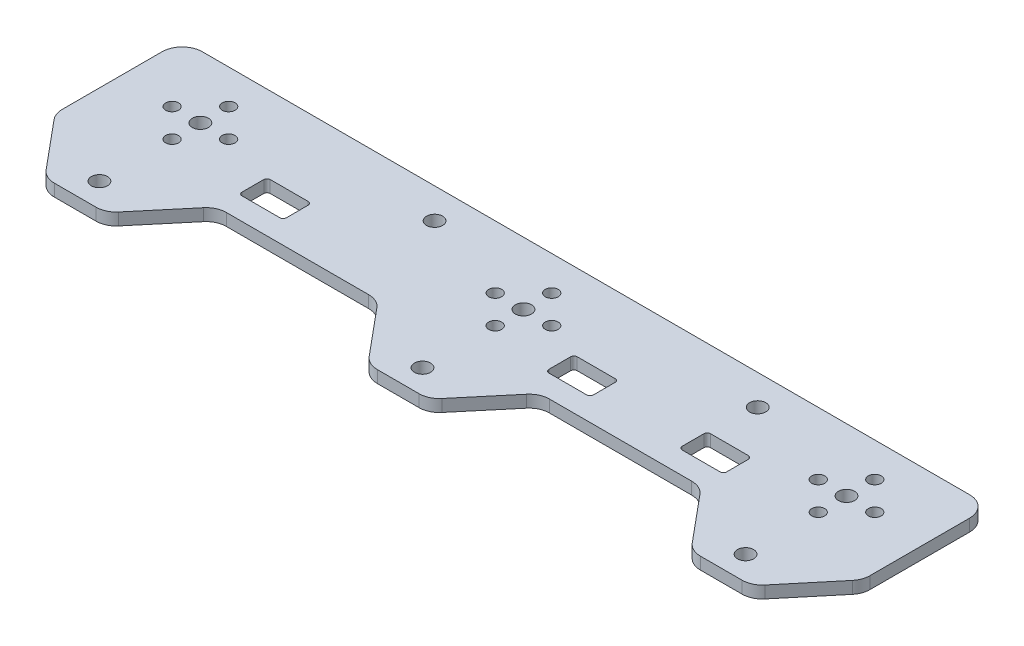
from build123d import *

# Parameters (mm, degrees)
SKETCH_1_W             = 200
SKETCH_1_H             = 48
EXTRUDE_1_DEPTH        = 3
SKETCH_2_R             = 2
CUT_EXTRUDE_1_DEPTH    = 3
SKETCH_3_R             = 10.5
CUT_EXTRUDE_2_DEPTH    = 0.1
SKETCH_5_R             = 2
SKETCH_5_R_2           = 1.6
CUT_EXTRUDE_3_DEPTH    = 10
SKETCH_7_W             = 200
SKETCH_7_H             = 1.5
CUT_EXTRUDE_4_DEPTH    = 10
SKETCH_9_R             = 10.5
SKETCH_9_R_2           = 1.6
SKETCH_9_R_3           = 2
EXTRUDE_3_DEPTH        = 0.1
CUT_EXTRUDE_3602_DEPTH = 10
SKETCH_11_W            = 11
SKETCH_11_H            = 7
CUT_EXTRUDE_6_DEPTH    = 10
FILLET_1_R             = 5
FILLET_2_R             = 5
FILLET_3_R             = 0.8


with BuildPart() as part:
    # 草图1 → 凸台-拉伸1 (new body)
    with BuildSketch(Plane(origin=(0, 0, 0), x_dir=(1, 0, 0), z_dir=(0, 1, 0))):
        Rectangle(SKETCH_1_W, SKETCH_1_H)
    extrude(amount=EXTRUDE_1_DEPTH)

    # 草图2 → 切除-拉伸1 (cut)
    with BuildSketch(Plane(origin=(0, 3, 0), x_dir=(1, 0, 0), z_dir=(0, 1, 0))):
        with Locations(Location((-80, -18, 0), (0, 0, 270))):
            Circle(SKETCH_2_R)
        with Locations(Location((0, -18, 0), (0, 0, 270))):
            Circle(SKETCH_2_R)
        with Locations(Location((80, -18, 0), (0, 0, 90))):
            Circle(SKETCH_2_R)
        with Locations(Location((-30, 15, 0), (0, 0, 270))):
            Circle(SKETCH_2_R)
        with Locations(Location((50, 15, 0), (0, 0, 270))):
            Circle(SKETCH_2_R)
    extrude(amount=-CUT_EXTRUDE_1_DEPTH, mode=Mode.SUBTRACT)

    # 草图3 → 切除-拉伸2 (cut)
    with BuildSketch(Plane(origin=(0, 3, 0), x_dir=(1, 0, 0), z_dir=(0, 1, 0))):
        with Locations(Location((-80, 7, 0), (0, 0, 270))):
            Circle(SKETCH_3_R)
        with Locations(Location((0, 7, 0), (0, 0, 270))):
            Circle(SKETCH_3_R)
        with Locations(Location((80, 7, 0), (0, 0, 90))):
            Circle(SKETCH_3_R)
    extrude(amount=-CUT_EXTRUDE_2_DEPTH, mode=Mode.SUBTRACT)

    # 草图5 → 切除-拉伸3 (cut)
    with BuildSketch(Plane(origin=(0, 3, 0), x_dir=(1, 0, 0), z_dir=(0, 1, 0))):
        with Locations(Location((0, 7, 0), (0, 0, 270))):
            Circle(SKETCH_5_R)
        with Locations(Location((0, 14, 0), (0, 0, 270))):
            Circle(SKETCH_5_R_2)
        with Locations(Location((-7, 7, 0), (0, 0, 270))):
            Circle(SKETCH_5_R_2)
        with Locations(Location((7, 7, 0), (0, 0, 270))):
            Circle(SKETCH_5_R_2)
        with Locations(Location((0, 0, 0), (0, 0, 270))):
            Circle(SKETCH_5_R_2)
        with Locations(Location((-80, 0, 0), (0, 0, 270))):
            Circle(SKETCH_5_R_2)
        with Locations(Location((-87, 7, 0), (0, 0, 270))):
            Circle(SKETCH_5_R_2)
        with Locations(Location((-73, 7, 0), (0, 0, 270))):
            Circle(SKETCH_5_R_2)
        with Locations(Location((-80, 14, 0), (0, 0, 270))):
            Circle(SKETCH_5_R_2)
        with Locations(Location((-80, 7, 0), (0, 0, 270))):
            Circle(SKETCH_5_R)
        with Locations(Location((80, 7, 0), (0, 0, 90))):
            Circle(SKETCH_5_R)
        with Locations(Location((80, 14, 0), (0, 0, 90))):
            Circle(SKETCH_5_R_2)
        with Locations(Location((73, 7, 0), (0, 0, 90))):
            Circle(SKETCH_5_R_2)
        with Locations(Location((87, 7, 0), (0, 0, 90))):
            Circle(SKETCH_5_R_2)
        with Locations(Location((80, 0, 0), (0, 0, 90))):
            Circle(SKETCH_5_R_2)
    extrude(amount=-CUT_EXTRUDE_3_DEPTH, mode=Mode.SUBTRACT)

    # 草图7 → 切除-拉伸4 (cut)
    with BuildSketch(Plane(origin=(0, 3, 0), x_dir=(1, 0, 0), z_dir=(0, 1, 0))):
        with Locations((0, 23.25)):
            Rectangle(SKETCH_7_W, SKETCH_7_H)
    extrude(amount=-CUT_EXTRUDE_4_DEPTH, mode=Mode.SUBTRACT)

    # 草图9 → 凸台-拉伸3 (add)
    # profile 1 of 3: a face of its own
    with BuildSketch(Plane(origin=(0, 3, 0), x_dir=(1, 0, 0), z_dir=(0, 1, 0))):
        with Locations((80, 7)):
            Circle(SKETCH_9_R)
        with Locations(Location((73, 7, 0), (0, 0, 270))):
            Circle(SKETCH_9_R_2, mode=Mode.SUBTRACT)
        with Locations(Location((80, 14, 0), (0, 0, 270))):
            Circle(SKETCH_9_R_2, mode=Mode.SUBTRACT)
        with Locations(Location((80, 7, 0), (0, 0, 270))):
            Circle(SKETCH_9_R_3, mode=Mode.SUBTRACT)
        with Locations(Location((87, 7, 0), (0, 0, 270))):
            Circle(SKETCH_9_R_2, mode=Mode.SUBTRACT)
        with Locations(Location((80, 0, 0), (0, 0, 270))):
            Circle(SKETCH_9_R_2, mode=Mode.SUBTRACT)
    # profile 2 of 3: a face of its own
    with BuildSketch(Plane(origin=(0, 3, 0), x_dir=(1, 0, 0), z_dir=(0, 1, 0))):
        with Locations((0, 7)):
            Circle(SKETCH_9_R)
        with Locations(Location((0, 7, 0), (0, 0, 270))):
            Circle(SKETCH_9_R_3, mode=Mode.SUBTRACT)
        with Locations(Location((0, 14, 0), (0, 0, 270))):
            Circle(SKETCH_9_R_2, mode=Mode.SUBTRACT)
        with Locations(Location((-7, 7, 0), (0, 0, 270))):
            Circle(SKETCH_9_R_2, mode=Mode.SUBTRACT)
        with Locations(Location((7, 7, 0), (0, 0, 270))):
            Circle(SKETCH_9_R_2, mode=Mode.SUBTRACT)
        with Locations(Location((0, 0, 0), (0, 0, 270))):
            Circle(SKETCH_9_R_2, mode=Mode.SUBTRACT)
    # profile 3 of 3: a face of its own
    with BuildSketch(Plane(origin=(0, 3, 0), x_dir=(1, 0, 0), z_dir=(0, 1, 0))):
        with Locations((-80, 7)):
            Circle(SKETCH_9_R)
        with Locations(Location((-87, 7, 0), (0, 0, 270))):
            Circle(SKETCH_9_R_2, mode=Mode.SUBTRACT)
        with Locations(Location((-80, 0, 0), (0, 0, 270))):
            Circle(SKETCH_9_R_2, mode=Mode.SUBTRACT)
        with Locations(Location((-80, 14, 0), (0, 0, 270))):
            Circle(SKETCH_9_R_2, mode=Mode.SUBTRACT)
        with Locations(Location((-73, 7, 0), (0, 0, 270))):
            Circle(SKETCH_9_R_2, mode=Mode.SUBTRACT)
        with Locations(Location((-80, 7, 0), (0, 0, 270))):
            Circle(SKETCH_9_R_3, mode=Mode.SUBTRACT)
    extrude(amount=-EXTRUDE_3_DEPTH)

    # 草图10 → Cut-Extrude 3602 (cut)
    with BuildSketch(Plane.XZ):
        Polygon((-100, 9), (-87.5, 24), (-100, 24), align=None)
        Polygon((-72.5, 24), (-7.5, 24), (-20, 9), (-59.913505532, 9), align=None)
        Polygon((72.5, 24), (7.5, 24), (20.086494468, 9), (60, 9), align=None)
        Polygon((87.5, 24), (100, 9), (100, 24), align=None)
    extrude(amount=-CUT_EXTRUDE_3602_DEPTH, mode=Mode.SUBTRACT)

    # 草图11 → 切除-拉伸6 (cut)
    with BuildSketch(Plane.XZ):
        with Locations((-54.5, 0)):
            Rectangle(SKETCH_11_W, SKETCH_11_H)
        with Locations((21.5, 0)):
            Rectangle(SKETCH_11_W, SKETCH_11_H)
        with Locations((54.5, 0)):
            Rectangle(SKETCH_11_W, SKETCH_11_H)
    extrude(amount=-CUT_EXTRUDE_6_DEPTH, mode=Mode.SUBTRACT)

    # 圆角1
    fillet_1_edges = [part.edges().sort_by_distance(p)[0] for p in [
        (100, 1.5, -22.5),
        (-100, 1.5, -22.5),
    ]]
    fillet(fillet_1_edges, radius=FILLET_1_R)

    # 圆角2
    fillet_2_edges = [part.edges().sort_by_distance(p)[0] for p in [
        (-100, 1.5, 9),
        (-87.5, 1.5, 24),
        (-7.5, 1.5, 24),
        (-20, 1.5, 9),
        (-59.913505532, 1.5, 9),
        (-72.5, 1.5, 24),
        (20.086494468, 1.5, 9),
        (7.5, 1.5, 24),
        (72.5, 1.5, 24),
        (60, 1.5, 9),
        (87.5, 1.5, 24),
        (100, 1.5, 9),
    ]]
    fillet(fillet_2_edges, radius=FILLET_2_R)

    # 圆角3
    fillet_3_edges = [part.edges().sort_by_distance(p)[0] for p in [
        (-60, 1.5, -3.5),
        (-60, 1.5, 3.5),
        (-49, 1.5, 3.5),
        (-49, 1.5, -3.5),
        (16, 1.5, -3.5),
        (16, 1.5, 3.5),
        (27, 1.5, 3.5),
        (27, 1.5, -3.5),
        (49, 1.5, -3.5),
        (49, 1.5, 3.5),
        (60, 1.5, 3.5),
        (60, 1.5, -3.5),
    ]]
    fillet(fillet_3_edges, radius=FILLET_3_R)


solid = part.part
